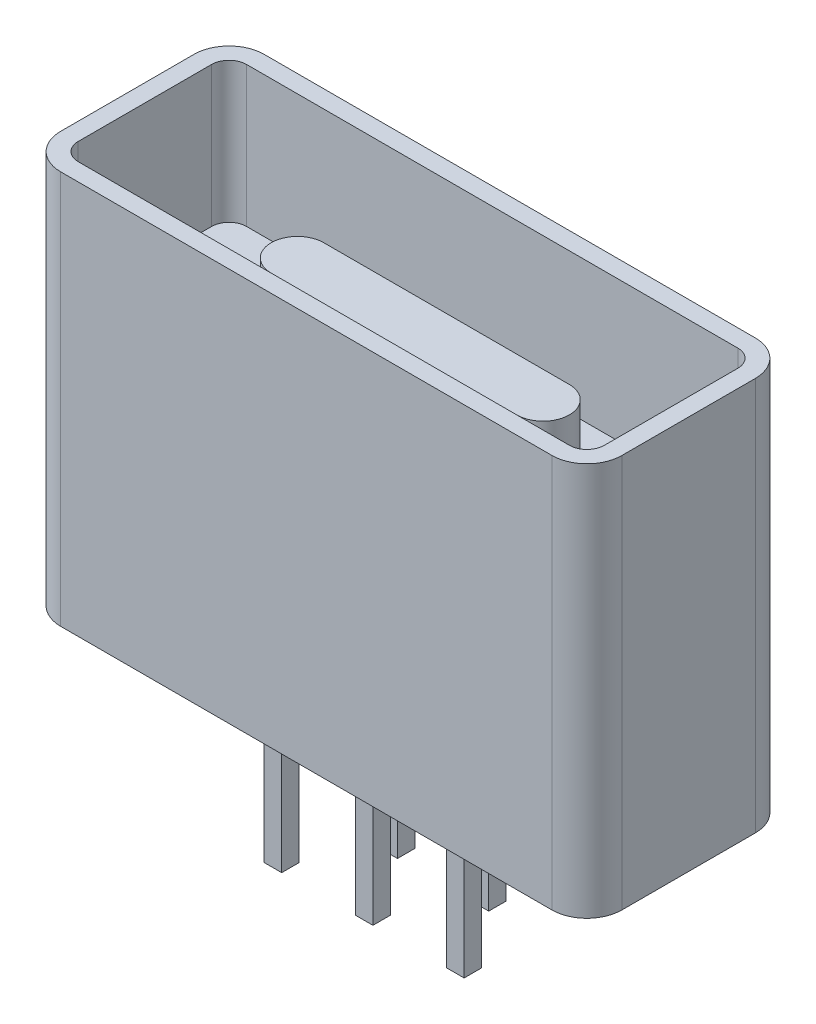
from build123d import *

# Parameters (mm, degrees)
SKETCH_1_W          = 8
SKETCH_1_H          = 2.9
EXTRUDE_1_DEPTH     = 5.61
SKETCH_2_W          = 0.25
SKETCH_2_H          = 0.25
EXTRUDE_2_DEPTH     = 2.29
FILLET_2_R          = 0.5
CUT_EXTRUDE_1_DEPTH = 2
EXTRUDE_3_DEPTH     = 1


with BuildPart() as part:
    # 草图1 → 凸台-拉伸1 (new body)
    with BuildSketch(Plane(origin=(0, 0, 0), x_dir=(1, 0, 0), z_dir=(0, 1, 0))):
        Rectangle(SKETCH_1_W, SKETCH_1_H)
    extrude(amount=EXTRUDE_1_DEPTH)

    # 草图2 → 凸台-拉伸2 (add)
    with BuildSketch(Plane.XZ):
        with Locations((-1.3, 0.5)):
            Rectangle(SKETCH_2_W, SKETCH_2_H)
        with Locations((1.3, 0.5)):
            Rectangle(SKETCH_2_W, SKETCH_2_H)
        with Locations((0, 0.5)):
            Rectangle(SKETCH_2_W, SKETCH_2_H)
        with Locations((-0.65, -0.5)):
            Rectangle(SKETCH_2_W, SKETCH_2_H)
        with Locations((0.65, -0.5)):
            Rectangle(SKETCH_2_W, SKETCH_2_H)
    extrude(amount=EXTRUDE_2_DEPTH)

    # 圆角2
    fillet_2_edges = [part.edges().sort_by_distance(p)[0] for p in [
        (-4, 2.805, -1.45),
        (4, 2.805, -1.45),
        (4, 2.805, 1.45),
        (-4, 2.805, 1.45),
    ]]
    fillet(fillet_2_edges, radius=FILLET_2_R)

    # 草图3 → 切除-拉伸1 (cut)
    with BuildSketch(Plane(origin=(0, 5.61, 0), x_dir=(1, 0, 0), z_dir=(0, 1, 0))):
        with BuildLine():
            Line((3.75, -0.95), (3.75, 0.95))
            ThreePointArc((3.75, 0.95), (3.676776695, 1.126776695), (3.5, 1.2))
            Line((3.5, 1.2), (-3.5, 1.2))
            ThreePointArc((-3.5, 1.2), (-3.676776695, 1.126776695), (-3.75, 0.95))
            Line((-3.75, 0.95), (-3.75, -0.95))
            ThreePointArc((-3.75, -0.95), (-3.676776695, -1.126776695), (-3.5, -1.2))
            Line((-3.5, -1.2), (3.5, -1.2))
            ThreePointArc((3.5, -1.2), (3.676776695, -1.126776695), (3.75, -0.95))
        make_face()
    extrude(amount=-CUT_EXTRUDE_1_DEPTH, mode=Mode.SUBTRACT)

    # 草图4 → 凸台-拉伸3 (add)
    with BuildSketch(Plane(origin=(0, 3.61, 0), x_dir=(1, 0, 0), z_dir=(0, 1, 0))):
        with BuildLine():
            Line((-1.75, 0.55), (1.75, 0.55))
            ThreePointArc((1.75, 0.55), (2.125, 0.175), (1.75, -0.2))
            Line((1.75, -0.2), (-1.75, -0.2))
            ThreePointArc((-1.75, -0.2), (-2.125, 0.175), (-1.75, 0.55))
        make_face()
    extrude(amount=EXTRUDE_3_DEPTH)


solid = part.part
